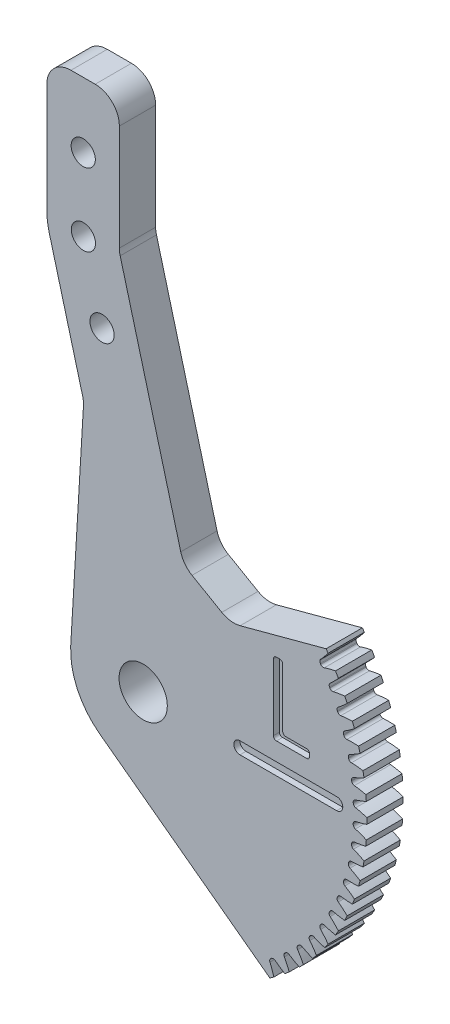
from build123d import *

# Parameters (mm, degrees)
SKETCH2_R                   = 60.325
BOSS_EXTRUDE2_DEPTH         = 4.7625
BOSS_EXTRUDE3_DEPTH         = 9.525
SKETCH4_W                   = 19.05
SKETCH4_H                   = 34.925
BOSS_EXTRUDE4_DEPTH         = 9.525
BOSS_EXTRUDE5_DEPTH         = 9.525
F_1_2_0_5_DIAMETER_HOLE1_D  = 12.6746
CUT_EXTRUDE1_DEPTH          = 146.316463062
CUT_EXTRUDE2_DEPTH          = 146.316463062
CUT_EXTRUDE3_DEPTH          = 12.7
F_1_4_0_25_DIAMETER_HOLE1_D = 6.35
FILLET1_R                   = 6.35
CUT_EXTRUDE4_DEPTH          = 1.5875
CUT_EXTRUDE5_DEPTH          = 1.5875
FILLET2_R                   = 0.79375


with BuildPart() as part:
    # Sketch2 → Boss-Extrude2 (new, symmetric)
    with BuildSketch(Plane.XY):
        with Locations(Location((0, 0, 0), (0, 0, 180))):
            Circle(SKETCH2_R)
    extrude(amount=BOSS_EXTRUDE2_DEPTH, both=True)

    # Sketch3 → Boss-Extrude3 (add)
    with BuildSketch(Plane.XY.offset(4.7625)):
        with BuildLine():
            Line((-15.613258896, 58.269475471), (-24.652514046, 92.004434954))
            Line((-24.652514046, 92.004434954), (-6.251627055, 96.934937763))
            Line((-6.251627055, 96.934937763), (3.586569747, 60.218287442))
            ThreePointArc((3.586569747, 60.218287442), (-6.091779707, 60.016629737), (-15.613258896, 58.269475471))
        make_face()
    extrude(amount=-BOSS_EXTRUDE3_DEPTH)



with BuildPart() as body_2:
    # Sketch4 → Boss-Extrude4 (new body)
    with BuildSketch(Plane.XY.offset(4.7625)):
        with Locations((-15.776627055, 114.397437763)):
            Rectangle(SKETCH4_W, SKETCH4_H)
    extrude(amount=-BOSS_EXTRUDE4_DEPTH)


with BuildPart() as part_1:
    add(part.part)

    add(body_2.part)  # Boss-Extrude5 merges body 2
    # Sketch5 → Boss-Extrude5 (add)
    with BuildSketch(Plane.XY.offset(4.7625)):
        with BuildLine():
            Line((-25.301627055, 96.934937763), (-6.251627055, 96.934937763))
            Line((-6.251627055, 96.934937763), (-24.652514046, 92.004434954))
            ThreePointArc((-24.652514046, 92.004434954), (-25.138651664, 94.448413801), (-25.301627055, 96.934937763))
        make_face()
    extrude(amount=-BOSS_EXTRUDE5_DEPTH)

    # 1/2 (0.5) Diameter Hole1 (through all)
    with Locations(Plane.XY.offset(4.7625)):
        with Locations((0, 0)):
            Hole(F_1_2_0_5_DIAMETER_HOLE1_D / 2)

    # Sketch8 → Cut-Extrude1 (cut, through all)
    with BuildSketch(Plane.XY.offset(4.7625)):
        with BuildLine():
            Line((22.918835565, 27.09572042), (49.652983315, 34.25911372))
            ThreePointArc((49.652983315, 34.25911372), (29.615573228, 52.554956449), (3.586569747, 60.218287442))
            Line((3.586569747, 60.218287442), (10.547952573, 34.238053046))
            Line((10.547952573, 34.238053046), (22.918835565, 27.09572042))
        make_face()
    extrude(amount=-CUT_EXTRUDE1_DEPTH, mode=Mode.SUBTRACT)

    # Sketch9 → Cut-Extrude2 (cut, through all)
    with BuildSketch(Plane.XY.offset(4.7625)):
        with BuildLine():
            Line((-15.613258896, 58.269475471), (-19.016301297, 1.132600973))
            ThreePointArc((-19.016301297, 1.132600973), (-17.265163343, -8.050877886), (-11.355820175, -15.29535381))
            Line((-11.355820175, -15.29535381), (34.600998523, -49.415347072))
            ThreePointArc((34.600998523, -49.415347072), (-54.673017253, -25.49444664), (-15.613258896, 58.269475471))
        make_face()
    extrude(amount=-CUT_EXTRUDE2_DEPTH, mode=Mode.SUBTRACT)

    # Sketch10 → Cut-Extrude3 (cut)
    with BuildSketch(Plane.XY.offset(4.7625)):
        with BuildLine():
            Line((25.576818402, -48.910388202), (25.394784128, -49.005149247))
            ThreePointArc((25.394784128, -49.005149247), (25.037565742, -49.381038951), (24.988673966, -49.897282731))
            ThreePointArc((24.988673966, -49.897282731), (25.299382599, -51.394607832), (25.508468358, -52.909469363))
            ThreePointArc((25.508468358, -52.909469363), (24.823540148, -53.234253641), (24.13447759, -53.55017178))
            ThreePointArc((24.13447759, -53.55017178), (23.108424067, -52.416268574), (22.161126153, -51.215789929))
            ThreePointArc((22.161126153, -51.215789929), (21.734233447, -50.921408097), (21.216669675, -50.953436013))
            Line((21.216669675, -50.953436013), (21.027069126, -51.031971131))
            ThreePointArc((21.027069126, -51.031971131), (20.638449117, -51.375296828), (20.544749779, -51.885314945))
            ThreePointArc((20.544749779, -51.885314945), (20.723775591, -53.404022314), (20.800036834, -54.931342364))
            ThreePointArc((20.800036834, -54.931342364), (20.089408168, -55.195195313), (19.375433621, -55.449855529))
            ThreePointArc((19.375433621, -55.449855529), (18.452110718, -54.23084071), (17.613046167, -52.952367796))
            ThreePointArc((17.613046167, -52.952367796), (17.213434983, -52.621900026), (16.695049281, -52.60869741))
            Line((16.695049281, -52.60869741), (16.499325433, -52.670408903))
            ThreePointArc((16.499325433, -52.670408903), (16.082261434, -52.978557676), (15.944467642, -53.478468584))
            ThreePointArc((15.944467642, -53.478468584), (15.990448138, -55.006999941), (15.93330447, -56.535154683))
            Line((15.93330447, -56.535154683), (15.202383662, -56.736068222))
            Line((15.202383662, -56.736068222), (16.435009364, -61.33628997))
            ThreePointArc((16.435009364, -61.33628997), (61.336289969, -16.435009364), (44.901280605, 44.901280605))
            Line((44.901280605, 44.901280605), (41.533684559, 41.53368456))
            Line((41.533684559, 41.53368456), (42.066223778, 40.994227926))
            ThreePointArc((42.066223778, 40.994227926), (41.351634275, 39.642235265), (40.54754832, 38.341478527))
            ThreePointArc((40.54754832, 38.341478527), (40.41692579, 37.839646085), (40.624039421, 37.36424942))
            Line((40.624039421, 37.36424942), (40.762685499, 37.212943776))
            ThreePointArc((40.762685499, 37.212943776), (41.218221994, 36.965184725), (41.729529316, 37.051572618))
            ThreePointArc((41.729529316, 37.051572618), (43.09541699, 37.739230364), (44.50454549, 38.333266713))
            ThreePointArc((44.50454549, 38.333266713), (44.995535477, 37.755737224), (45.479031479, 37.171919535))
            ThreePointArc((45.479031479, 37.171919535), (44.64932728, 35.887352193), (43.734932695, 34.661625937))
            ThreePointArc((43.734932695, 34.661625937), (43.561069644, 34.173087622), (43.725961596, 33.681448842))
            Line((43.725961596, 33.681448842), (43.850892929, 33.518635159))
            ThreePointArc((43.850892929, 33.518635159), (44.283102346, 33.232116285), (44.79999319, 33.273612076))
            ThreePointArc((44.79999319, 33.273612076), (46.220616571, 33.839608122), (47.67615659, 34.308570342))
            ThreePointArc((47.67615659, 34.308570342), (48.1149432, 33.69044593), (48.54571629, 33.066710389))
            ThreePointArc((48.54571629, 33.066710389), (47.607211946, 31.8593447), (46.589467827, 30.717977442))
            ThreePointArc((46.589467827, 30.717977442), (46.373687457, 30.246451326), (46.495102803, 29.7423121))
            Line((46.495102803, 29.7423121), (46.605368586, 29.569229491))
            ThreePointArc((46.605368586, 29.569229491), (47.01096155, 29.246131375), (47.529502065, 29.242419256))
            ThreePointArc((47.529502065, 29.242419256), (48.99404935, 29.68244603), (50.484923351, 30.022765035))
            ThreePointArc((50.484923351, 30.022765035), (50.868167154, 29.36875), (51.242938888, 28.709843613))
            ThreePointArc((51.242938888, 28.709843613), (50.202776982, 27.588868358), (49.089428975, 26.540546591))
            ThreePointArc((49.089428975, 26.540546591), (48.833373506, 26.089621273), (48.910388201, 25.576818404))
            Line((48.910388201, 25.576818404), (49.005149246, 25.39478413))
            ThreePointArc((49.005149246, 25.39478413), (49.381038951, 25.037565743), (49.89728273, 24.988673967))
            ThreePointArc((49.89728273, 24.988673967), (51.394607831, 25.2993826), (52.909469362, 25.508468358))
            ThreePointArc((52.909469362, 25.508468358), (53.234253641, 24.823540148), (53.55017178, 24.13447759))
            ThreePointArc((53.55017178, 24.13447759), (52.416268573, 23.108424067), (51.215789929, 22.161126154))
            ThreePointArc((51.215789929, 22.161126154), (50.921408098, 21.734233447), (50.953436013, 21.216669675))
            Line((50.953436013, 21.216669675), (51.031971132, 21.027069126))
            ThreePointArc((51.031971132, 21.027069126), (51.375296828, 20.638449117), (51.885314945, 20.544749779))
            ThreePointArc((51.885314945, 20.544749779), (53.404022314, 20.723775591), (54.931342364, 20.800036834))
            ThreePointArc((54.931342364, 20.800036834), (55.195195313, 20.089408168), (55.449855529, 19.375433621))
            ThreePointArc((55.449855529, 19.375433621), (54.23084071, 18.452110718), (52.952367796, 17.613046167))
            ThreePointArc((52.952367796, 17.613046167), (52.621900025, 17.213434983), (52.60869741, 16.695049281))
            Line((52.60869741, 16.695049281), (52.670408902, 16.499325433))
            ThreePointArc((52.670408902, 16.499325433), (52.978557675, 16.082261434), (53.478468584, 15.944467642))
            ThreePointArc((53.478468584, 15.944467642), (55.00699994, 15.990448138), (56.535154682, 15.93330447))
            ThreePointArc((56.535154682, 15.93330447), (56.736068222, 15.202383662), (56.927532397, 14.468930904))
            ThreePointArc((56.927532397, 14.468930904), (55.632683403, 13.655365665), (54.28594617, 12.930920264))
            ThreePointArc((54.28594617, 12.930920264), (53.921907519, 12.561631885), (53.863574853, 12.04636948))
            Line((53.863574853, 12.04636948), (53.907993057, 11.846011911))
            ThreePointArc((53.907993057, 11.846011911), (54.178619708, 11.403678031), (54.664618784, 11.222838479))
            ThreePointArc((54.664618784, 11.222838479), (56.191341082, 11.135423719), (57.708700334, 10.945310039))
            ThreePointArc((57.708700334, 10.945310039), (57.845145391, 10.199659835), (57.971956367, 9.452310883))
            ThreePointArc((57.971956367, 9.452310883), (56.611127784, 8.754695032), (55.206375716, 8.150382249))
            ThreePointArc((55.206375716, 8.150382249), (54.81153674, 7.814227183), (54.708517969, 7.306009534))
            Line((54.708517969, 7.306009534), (54.735304836, 7.102543083))
            ThreePointArc((54.735304836, 7.102543083), (54.966349733, 6.638305751), (55.434738231, 6.415796738))
            ThreePointArc((55.434738231, 6.415796738), (56.94803219, 6.195652002), (58.443047933, 5.874015189))
            ThreePointArc((58.443047933, 5.874015189), (58.513986078, 5.11931044), (58.575178747, 4.363753072))
            ThreePointArc((58.575178747, 4.363753072), (57.158727299, 3.787395886), (55.706651408, 3.307814905))
            ThreePointArc((55.706651408, 3.307814905), (55.284017068, 3.007351495), (55.137096229, 2.510046445))
            Line((55.137096229, 2.510046445), (55.146047893, 2.305019615))
            ThreePointArc((55.146047893, 2.305019615), (55.335752646, 1.822411956), (55.782965846, 1.55992691))
            ThreePointArc((55.782965846, 1.55992691), (57.271314386, 1.208727632), (58.732608647, 0.758015537))
            ThreePointArc((58.732608647, 0.758015537), (58.737499999, 0), (58.732608647, -0.758015537))
            ThreePointArc((58.732608647, -0.758015537), (57.271314386, -1.208727632), (55.782965846, -1.55992691))
            ThreePointArc((55.782965846, -1.55992691), (55.335752646, -1.822411956), (55.146047894, -2.305019615))
            Line((55.146047894, -2.305019615), (55.137096229, -2.510046445))
            ThreePointArc((55.137096229, -2.510046445), (55.284017068, -3.007351494), (55.706651406, -3.307814905))
            ThreePointArc((55.706651406, -3.307814905), (57.158727298, -3.787395885), (58.575178747, -4.363753072))
            ThreePointArc((58.575178747, -4.363753072), (58.513986078, -5.119310439), (58.443047933, -5.874015188))
            ThreePointArc((58.443047933, -5.874015188), (56.94803219, -6.195652001), (55.434738231, -6.415796737))
            ThreePointArc((55.434738231, -6.415796737), (54.966349733, -6.63830575), (54.735304836, -7.102543082))
            Line((54.735304836, -7.102543082), (54.708517969, -7.306009535))
            ThreePointArc((54.708517969, -7.306009535), (54.811536739, -7.814227184), (55.206375714, -8.15038225))
            ThreePointArc((55.206375714, -8.15038225), (56.611127783, -8.754695033), (57.971956368, -9.452310884))
            ThreePointArc((57.971956368, -9.452310884), (57.845145392, -10.199659836), (57.708700335, -10.945310039))
            ThreePointArc((57.708700335, -10.945310039), (56.191341082, -11.135423719), (54.664618786, -11.222838479))
            ThreePointArc((54.664618786, -11.222838479), (54.178619709, -11.40367803), (53.907993058, -11.84601191))
            Line((53.907993058, -11.84601191), (53.863574854, -12.046369481))
            ThreePointArc((53.863574854, -12.046369481), (53.921907519, -12.561631885), (54.285946169, -12.930920264))
            ThreePointArc((54.285946169, -12.930920264), (55.632683402, -13.655365665), (56.927532396, -14.468930903))
            ThreePointArc((56.927532396, -14.468930903), (56.736068221, -15.202383662), (56.535154681, -15.93330447))
            ThreePointArc((56.535154681, -15.93330447), (55.00699994, -15.990448138), (53.478468584, -15.944467643))
            ThreePointArc((53.478468584, -15.944467643), (52.978557675, -16.082261434), (52.670408902, -16.499325433))
            Line((52.670408902, -16.499325433), (52.608697409, -16.695049282))
            ThreePointArc((52.608697409, -16.695049282), (52.621900025, -17.213434984), (52.952367795, -17.613046168))
            ThreePointArc((52.952367795, -17.613046168), (54.230840709, -18.452110719), (55.449855529, -19.375433622))
            ThreePointArc((55.449855529, -19.375433622), (55.195195313, -20.089408169), (54.931342364, -20.800036835))
            ThreePointArc((54.931342364, -20.800036835), (53.404022313, -20.723775592), (51.885314944, -20.544749781))
            ThreePointArc((51.885314944, -20.544749781), (51.375296827, -20.638449119), (51.03197113, -21.027069128))
            Line((51.03197113, -21.027069128), (50.953436012, -21.216669677))
            ThreePointArc((50.953436012, -21.216669677), (50.921408096, -21.734233449), (51.215789928, -22.161126155))
            ThreePointArc((51.215789928, -22.161126155), (52.416268573, -23.108424069), (53.550171779, -24.134477591))
            ThreePointArc((53.550171779, -24.134477591), (53.234253641, -24.823540149), (52.909469363, -25.508468358))
            ThreePointArc((52.909469363, -25.508468358), (51.394607832, -25.299382599), (49.897282731, -24.988673966))
            ThreePointArc((49.897282731, -24.988673966), (49.381038951, -25.037565742), (49.005149246, -25.394784128))
            Line((49.005149246, -25.394784128), (48.9103882, -25.576818404))
            ThreePointArc((48.9103882, -25.576818404), (48.833373505, -26.089621273), (49.089428974, -26.540546591))
            ThreePointArc((49.089428974, -26.540546591), (50.202776982, -27.588868358), (51.242938888, -28.709843613))
            ThreePointArc((51.242938888, -28.709843613), (50.868167154, -29.36875), (50.484923351, -30.022765036))
            ThreePointArc((50.484923351, -30.022765036), (48.994049349, -29.68244603), (47.529502064, -29.242419255))
            ThreePointArc((47.529502064, -29.242419255), (47.010961549, -29.246131374), (46.605368585, -29.56922949))
            Line((46.605368585, -29.56922949), (46.495102802, -29.742312099))
            ThreePointArc((46.495102802, -29.742312099), (46.373687456, -30.246451326), (46.589467826, -30.717977441))
            ThreePointArc((46.589467826, -30.717977441), (47.607211946, -31.8593447), (48.545716291, -33.06671039))
            ThreePointArc((48.545716291, -33.06671039), (48.114943201, -33.69044593), (47.67615659, -34.308570342))
            ThreePointArc((47.67615659, -34.308570342), (46.220616571, -33.839608121), (44.79999319, -33.273612075))
            ThreePointArc((44.79999319, -33.273612075), (44.283102346, -33.232116284), (43.850892929, -33.518635159))
            Line((43.850892929, -33.518635159), (43.725961596, -33.681448842))
            ThreePointArc((43.725961596, -33.681448842), (43.561069644, -34.173087621), (43.734932695, -34.661625936))
            ThreePointArc((43.734932695, -34.661625936), (44.649327281, -35.887352193), (45.47903148, -37.171919534))
            ThreePointArc((45.47903148, -37.171919534), (44.995535477, -37.755737224), (44.50454549, -38.333266713))
            ThreePointArc((44.50454549, -38.333266713), (43.095416991, -37.739230364), (41.729529317, -37.051572618))
            ThreePointArc((41.729529317, -37.051572618), (41.218221995, -36.965184725), (40.7626855, -37.212943776))
            Line((40.7626855, -37.212943776), (40.624039422, -37.36424942))
            ThreePointArc((40.624039422, -37.36424942), (40.41692579, -37.839646085), (40.54754832, -38.341478528))
            ThreePointArc((40.54754832, -38.341478528), (41.351634276, -39.642235265), (42.066223779, -40.994227926))
            ThreePointArc((42.066223779, -40.994227926), (41.53368456, -41.53368456), (40.994227926, -42.066223779))
            ThreePointArc((40.994227926, -42.066223779), (39.642235265, -41.351634276), (38.341478528, -40.547548321))
            ThreePointArc((38.341478528, -40.547548321), (37.839646085, -40.416925791), (37.36424942, -40.624039422))
            Line((37.36424942, -40.624039422), (37.212943775, -40.762685501))
            ThreePointArc((37.212943775, -40.762685501), (36.965184725, -41.218221996), (37.051572617, -41.729529318))
            ThreePointArc((37.051572617, -41.729529318), (37.739230364, -43.095416991), (38.333266714, -44.504545491))
            ThreePointArc((38.333266714, -44.504545491), (37.755737224, -44.995535478), (37.171919534, -45.479031481))
            ThreePointArc((37.171919534, -45.479031481), (35.887352191, -44.649327282), (34.661625934, -43.734932696))
            ThreePointArc((34.661625934, -43.734932696), (34.17308762, -43.561069645), (33.68144884, -43.725961597))
            Line((33.68144884, -43.725961597), (33.518635159, -43.850892929))
            ThreePointArc((33.518635159, -43.850892929), (33.232116284, -44.283102346), (33.273612075, -44.79999319))
            ThreePointArc((33.273612075, -44.79999319), (33.839608121, -46.220616571), (34.308570342, -47.67615659))
            ThreePointArc((34.308570342, -47.67615659), (33.69044593, -48.114943201), (33.066710389, -48.545716291))
            ThreePointArc((33.066710389, -48.545716291), (31.8593447, -47.607211947), (30.717977441, -46.589467827))
            ThreePointArc((30.717977441, -46.589467827), (30.246451326, -46.373687458), (29.7423121, -46.495102803))
            Line((29.7423121, -46.495102803), (29.569229488, -46.605368588))
            ThreePointArc((29.569229488, -46.605368588), (29.246131371, -47.010961552), (29.242419253, -47.529502067))
            ThreePointArc((29.242419253, -47.529502067), (29.682446028, -48.994049352), (30.022765036, -50.484923353))
            ThreePointArc((30.022765036, -50.484923353), (29.36875, -50.868167156), (28.709843612, -51.24293889))
            ThreePointArc((28.709843612, -51.24293889), (27.588868356, -50.202776984), (26.540546589, -49.089428976))
            ThreePointArc((26.540546589, -49.089428976), (26.089621271, -48.833373507), (25.576818402, -48.910388202))
        make_face()
    extrude(amount=-CUT_EXTRUDE3_DEPTH, mode=Mode.SUBTRACT)

    # 1/4 (0.25) Diameter Hole1 (through all)
    with Locations(Plane.XY.offset(4.7625)):
        with Locations((-15.738059326, 114.741675782), (-15.69513936, 95.691675782), (-10.806106463, 77.279727017)):
            Hole(F_1_4_0_25_DIAMETER_HOLE1_D / 2)

    # Fillet1
    fillet1_edges = [part_1.edges().sort_by_distance(p)[0] for p in [
        (-6.251627055, 131.859937763, 0),
        (-25.301627055, 131.859937763, 0),
        (22.918835565, 27.09572042, 0),
        (10.547952573, 34.238053046, 0),
        (-15.613258896, 58.269475471, 0),
        (-6.251627055, 96.934937763, 0),
    ]]
    fillet(fillet1_edges, radius=FILLET1_R)

    # Sketch13 → Cut-Extrude4 (cut)
    with BuildSketch(Plane.XY.offset(4.7625)):
        with BuildLine():
            Line((25.4, 1.6002), (50.8, 1.6002))
            ThreePointArc((50.8, 1.6002), (52.4002, 0), (50.8, -1.6002))
            Line((50.8, -1.6002), (25.4, -1.6002))
            ThreePointArc((25.4, -1.6002), (23.7998, 0), (25.4, 1.6002))
        make_face()
    extrude(amount=-CUT_EXTRUDE4_DEPTH, mode=Mode.SUBTRACT)

    # Sketch14 → Cut-Extrude5 (cut)
    with BuildSketch(Plane.XY.offset(4.7625)):
        Polygon((34.192307692, 25.4), (36.634615385, 25.4), (36.634615385, 8.548076923), (43.717307692, 8.548076923), (43.717307692, 6.35), (34.192307692, 6.35), align=None)
    extrude(amount=-CUT_EXTRUDE5_DEPTH, mode=Mode.SUBTRACT)

    # Fillet2
    fillet2_edges = [part_1.edges().sort_by_distance(p)[0] for p in [
        (34.192307692, 6.35, 3.96875),
        (34.192307692, 25.4, 3.96875),
        (36.634615385, 25.4, 3.96875),
        (36.634615385, 8.548076923, 3.96875),
        (43.717307692, 8.548076923, 3.96875),
        (43.717307692, 6.35, 3.96875),
    ]]
    fillet(fillet2_edges, radius=FILLET2_R)


solid = part_1.part
